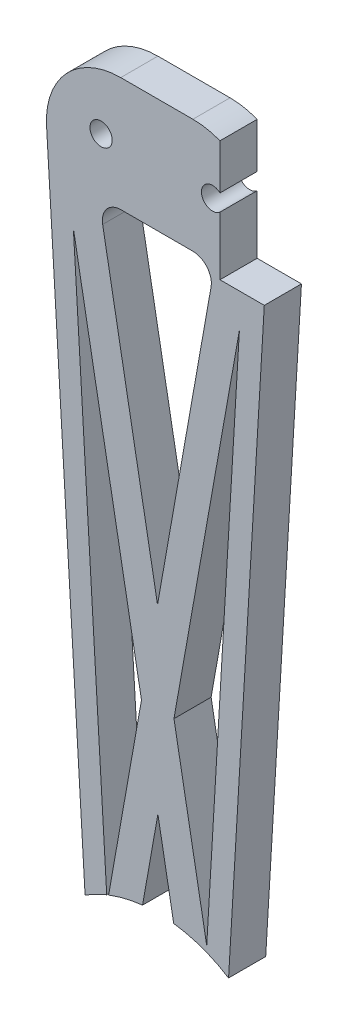
from build123d import *

# Parameters (mm, degrees)
SKETCH1_R           = 3
BOSS_EXTRUDE2_DEPTH = 10
FILLET1_R           = 20
FILLET2_R           = 20
CUT_EXTRUDE1_START  = -10
CUT_EXTRUDE1_DEPTH  = 10
FILLET3_R           = 5
CUT_EXTRUDE3_START  = -10
SKETCH5_W           = 12
SKETCH5_H           = 10
CUT_EXTRUDE3_DEPTH  = 10


with BuildPart() as part:
    # Sketch1 → Boss-Extrude2 (new body)
    with BuildSketch(Plane.XY):
        with BuildLine():
            Line((-30, 15.770412854), (-30, 0))
            Line((-30, 0), (-17.5, -210))
            ThreePointArc((-17.5, -210), (0, -227.5), (17.5, -210))
            Line((17.5, -210), (30, 0))
            Line((30, 0), (30, 15.770412854))
            Line((30, 15.770412854), (-30, 15.770412854))
        make_face()
        with Locations((-15, 0)):
            Circle(SKETCH1_R, mode=Mode.SUBTRACT)
        with Locations((15, 0)):
            Circle(SKETCH1_R, mode=Mode.SUBTRACT)
        Polygon((0, -205), (6, -205), (6, -215), (-6, -215), (-6, -205), align=None, mode=Mode.SUBTRACT)
    extrude(amount=BOSS_EXTRUDE2_DEPTH)

    # Fillet1
    fillet1_edges = [part.edges().sort_by_distance(p)[0] for p in [
        (-30, 15.770412854, 5),
    ]]
    fillet(fillet1_edges, radius=FILLET1_R)

    # Fillet2
    fillet2_edges = [part.edges().sort_by_distance(p)[0] for p in [
        (30, 15.770412854, 5),
    ]]
    fillet(fillet2_edges, radius=FILLET2_R)

    # Sketch4 → Cut-Extrude1 (cut)
    with BuildSketch(Plane.XY.offset(10).offset(CUT_EXTRUDE1_START)):
        Polygon((-15.651797422, -15), (0.190220551, -102.160979768), (15.643622882, -15), (15, -15), align=None)
        Polygon((-22.473027071, -25.6531452), (-13.367328465, -178.628881795), (-4.134156204, -126.551525408), align=None)
        Polygon((22.230419841, -27.161313899), (4.615986353, -126.511039477), (13.430162671, -175.005634359), align=None)
        with BuildLine():
            Line((0.291609598, -150.901585116), (-7.372445375, -194.128735111))
            ThreePointArc((-7.372445375, -194.128735111), (0.476576628, -192.506490497), (8.225632191, -194.553674383))
            Line((8.225632191, -194.553674383), (0.291609598, -150.901585116))
        make_face()
    extrude(amount=CUT_EXTRUDE1_DEPTH, mode=Mode.SUBTRACT)

    # Fillet3
    fillet3_edges = [part.edges().sort_by_distance(p)[0] for p in [
        (8.225632191, -194.553674383, 5),
        (-7.372445375, -194.128735111, 5),
        (-15.651797422, -15, 5),
        (15.643622882, -15, 5),
    ]]
    fillet(fillet3_edges, radius=FILLET3_R)

    # Sketch5 → Cut-Extrude3 (cut)
    # profile 1 of 10: a face of its own
    with BuildSketch(Plane.XY.offset(10).offset(CUT_EXTRUDE3_START)):
        with BuildLine():
            Line((-4.167269409, -176.050756454), (-4.122092315, -175.795946561))
            Line((-4.122092315, -175.795946561), (-11.228656567, -175.795946561))
            ThreePointArc((-11.228656567, -175.795946561), (-12.106175916, -176.096600396), (-12.975657802, -176.419763184))
            Line((-12.975657802, -176.419763184), (-13.345719148, -178.506999951))
            ThreePointArc((-13.345719148, -178.506999951), (-8.842198544, -176.958619935), (-4.167269409, -176.050756454))
        make_face()
    # profile 2 of 10: a face of its own
    with BuildSketch(Plane.XY.offset(10).offset(CUT_EXTRUDE3_START)):
        with BuildLine():
            ThreePointArc((-13.486799408, -176.621769943), (-16.46588928, -177.986339006), (-19.308563513, -179.61613298))
            Line((-19.308563513, -179.61613298), (-19.185515511, -181.683339422))
            ThreePointArc((-19.185515511, -181.683339422), (-16.356398794, -179.96026814), (-13.373872309, -178.518945203))
            Line((-13.373872309, -178.518945203), (-13.486799408, -176.621769943))
        make_face()
    # profile 3 of 10: a face of its own
    with BuildSketch(Plane.XY.offset(10).offset(CUT_EXTRUDE3_START)):
        with BuildLine():
            Line((-4.122092315, -175.795946561), (-3.840092025, -174.205395752))
            ThreePointArc((-3.840092025, -174.205395752), (-7.576229867, -174.806240028), (-11.228656567, -175.795946561))
            Line((-11.228656567, -175.795946561), (-4.122092315, -175.795946561))
        make_face()
    # profile 4 of 10: a face of its own
    with BuildSketch(Plane.XY.offset(10).offset(CUT_EXTRUDE3_START)):
        with BuildLine():
            Line((4.816305425, -175.795946561), (11.228656567, -175.795946561))
            ThreePointArc((11.228656567, -175.795946561), (7.921392788, -174.882318751), (4.542172021, -174.287695771))
            Line((4.542172021, -174.287695771), (4.816305425, -175.795946561))
        make_face()
    # profile 5 of 10: a face of its own
    with BuildSketch(Plane.XY.offset(10).offset(CUT_EXTRUDE3_START)):
        with BuildLine():
            ThreePointArc((19.308563513, -179.61613298), (15.387621929, -177.454323), (11.228656567, -175.795946561))
            Line((11.228656567, -175.795946561), (4.816305425, -175.795946561))
            Line((4.816305425, -175.795946561), (4.879901452, -176.145844664))
            ThreePointArc((4.879901452, -176.145844664), (12.347146855, -178.102269105), (19.185515511, -181.683339422))
            Line((19.185515511, -181.683339422), (19.308563513, -179.61613298))
        make_face()
    # profile 6 of 10: a face of its own
    with BuildSketch(Plane.XY.offset(10).offset(CUT_EXTRUDE3_START)):
        with BuildLine():
            Line((18.887385797, -186.691918617), (19.185515511, -181.683339422))
            ThreePointArc((19.185515511, -181.683339422), (12.347146855, -178.102269105), (4.879901452, -176.145844664))
            Line((4.879901452, -176.145844664), (5.679005105, -180.54242201))
            ThreePointArc((5.679005105, -180.54242201), (12.662186526, -182.803142969), (18.887385797, -186.691918617))
        make_face()
    # profile 7 of 10: a face of its own
    with BuildSketch(Plane.XY.offset(10).offset(CUT_EXTRUDE3_START)):
        with BuildLine():
            Line((17.5, -210), (18.887385797, -186.691918617))
            ThreePointArc((18.887385797, -186.691918617), (12.662186526, -182.803142969), (5.679005105, -180.54242201))
            Line((5.679005105, -180.54242201), (6.795310384, -186.684206595))
            ThreePointArc((6.795310384, -186.684206595), (5.577551358, -190.939561161), (1.45903868, -192.560928748))
            ThreePointArc((1.45903868, -192.560928748), (0.292984986, -192.502452749), (-0.874372768, -192.521857299))
            ThreePointArc((-0.874372768, -192.521857299), (-4.874459747, -190.834989527), (-6.047413252, -186.655228912))
            Line((-6.047413252, -186.655228912), (-4.940068564, -180.409533248))
            ThreePointArc((-4.940068564, -180.409533248), (-12.320876057, -182.646828096), (-18.887385797, -186.691918617))
            Line((-18.887385797, -186.691918617), (-17.5, -210))
            ThreePointArc((-17.5, -210), (0, -227.5), (17.5, -210))
        make_face()
        with Locations((0, -210)):
            Rectangle(SKETCH5_W, SKETCH5_H, mode=Mode.SUBTRACT)
    # profile 8 of 10: a face of its own
    with BuildSketch(Plane.XY.offset(10).offset(CUT_EXTRUDE3_START)):
        with BuildLine():
            Line((-4.940068564, -180.409533248), (-4.167269409, -176.050756454))
            ThreePointArc((-4.167269409, -176.050756454), (-8.842198544, -176.958619935), (-13.345719148, -178.506999951))
            Line((-13.345719148, -178.506999951), (-13.367328465, -178.628881795))
            Line((-13.367328465, -178.628881795), (-13.373872309, -178.518945203))
            ThreePointArc((-13.373872309, -178.518945203), (-16.356398794, -179.96026814), (-19.185515511, -181.683339422))
            Line((-19.185515511, -181.683339422), (-18.887385797, -186.691918617))
            ThreePointArc((-18.887385797, -186.691918617), (-12.320876057, -182.646828096), (-4.940068564, -180.409533248))
        make_face()
    # profile 9 of 10: a face of its own
    with BuildSketch(Plane.XY.offset(10).offset(CUT_EXTRUDE3_START)):
        with BuildLine():
            ThreePointArc((17, 2.236067977), (17.738612788, 1.224744871), (18, 0))
            Line((18, 0), (29.260488635, 0))
            ThreePointArc((29.260488635, 0), (24.938968919, 8.738256866), (17, 14.39559177))
            Line((17, 14.39559177), (17, 2.236067977))
        make_face()
    # profile 10 of 10: a face of its own
    with BuildSketch(Plane.XY.offset(10).offset(CUT_EXTRUDE3_START)):
        with BuildLine():
            Line((29.260488635, 0), (18, 0))
            ThreePointArc((18, 0), (17.738612788, -1.224744871), (17, -2.236067977))
            Line((17, -2.236067977), (17, -18))
            Line((17, -18), (28.928571429, -18))
            Line((28.928571429, -18), (29.677502384, -5.417959945))
            ThreePointArc((29.677502384, -5.417959945), (29.653859351, -2.694751229), (29.260488635, 0))
        make_face()
    extrude(amount=CUT_EXTRUDE3_DEPTH, mode=Mode.SUBTRACT)


solid = part.part
